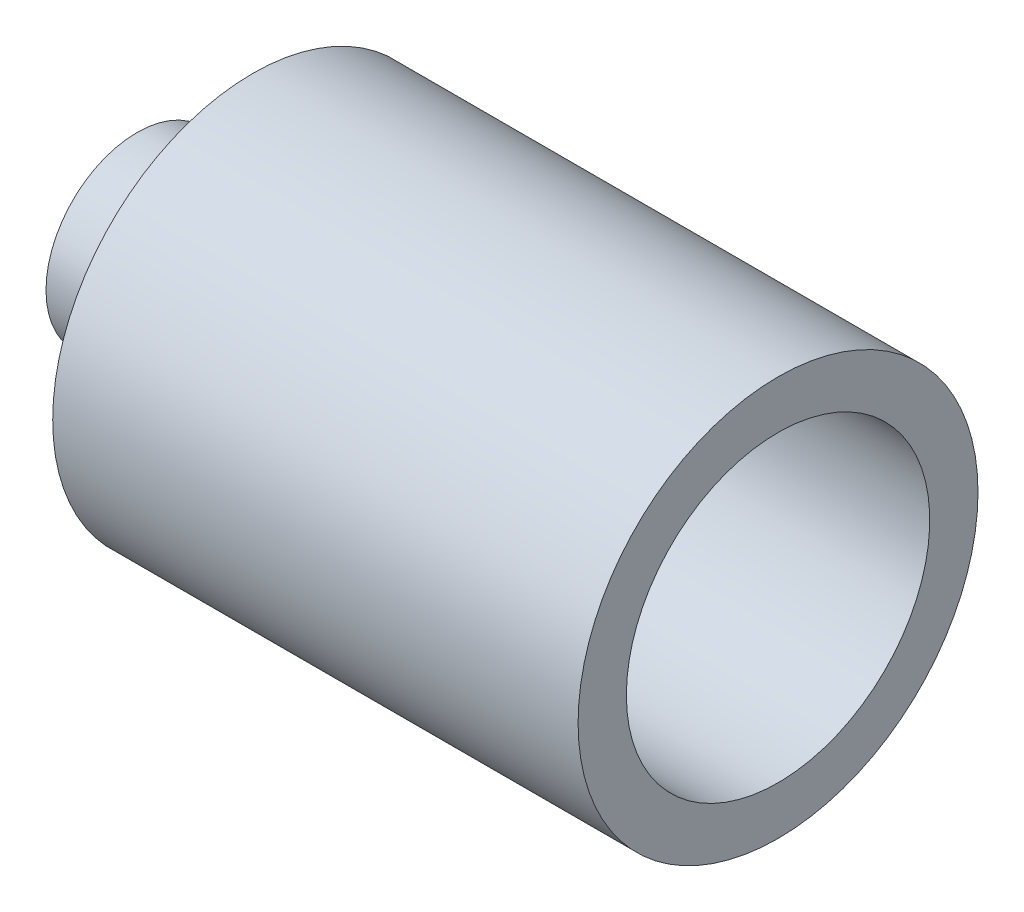
from build123d import *


with BuildPart() as part:
    # Sketch1 → Revolve1 (revolve)
    with BuildSketch(Plane.XY):
        Polygon((38.1, 11), (38.1, 14.5), (0, 14.5), (0, 6.604), (-8.382, 6.604), (-8.382, 3.429), (5.08, 3.429), (5.08, 11), align=None)
    revolve(axis=Axis((0, 0, 0), (1, 0, 0)))


solid = part.part
